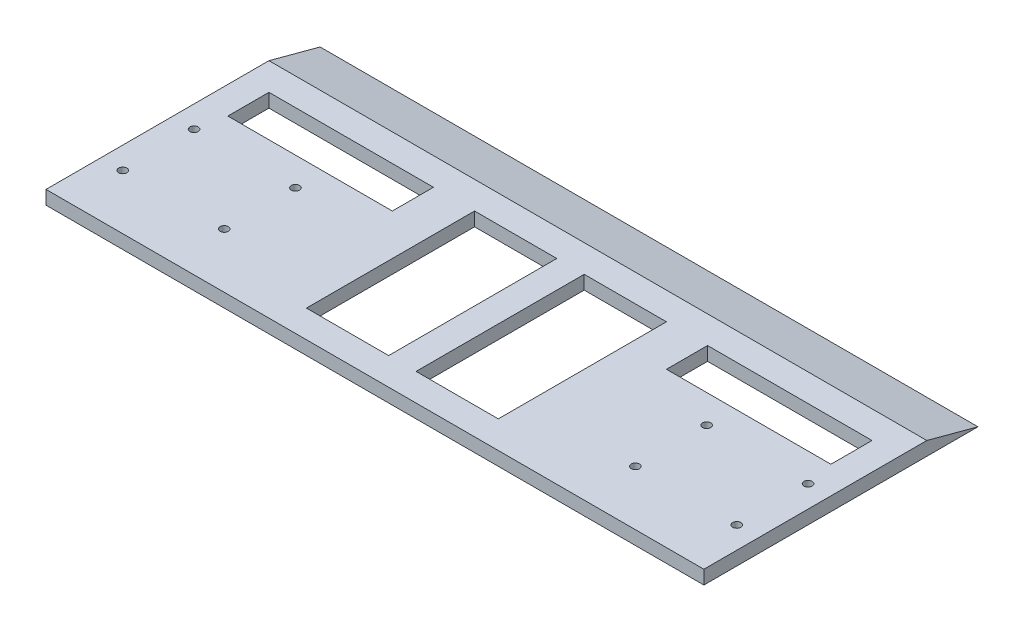
from build123d import *

# Parameters (mm, degrees)
SKETCH_1_W          = 240
SKETCH_1_H          = 100
EXTRUDE_1_DEPTH     = 2.5
CUT_EXTRUDE_1_DEPTH = 261.012018953
SKETCH_3_R          = 1.5
CUT_EXTRUDE_2_DEPTH = 261.048072479
SKETCH_5_W          = 70
SKETCH_5_H          = 61.339745962
CUT_EXTRUDE_4_DEPTH = 10
SKETCH_6_W          = 60
SKETCH_6_H          = 15
CUT_EXTRUDE_5_DEPTH = 10
SKETCH_7_W          = 10
SKETCH_7_H          = 5
EXTRUDE_2_DEPTH     = 70
CHAMFER_1_SIZE      = 1.12


with BuildPart() as part:
    # 草图1 → 凸台-拉伸1 (new, symmetric)
    with BuildSketch(Plane(origin=(0, 0, 0), x_dir=(1, 0, 0), z_dir=(0, 1, 0))):
        with Locations((120, -50)):
            Rectangle(SKETCH_1_W, SKETCH_1_H)
    extrude(amount=EXTRUDE_1_DEPTH, both=True)

    # 草图2 → 切除-拉伸1 (cut, through all)
    with BuildSketch(Plane(origin=(240, 0, 0), x_dir=(0, 0, -1), z_dir=(1, 0, 0))):
        Polygon((0, -2.5), (-18.660254038, 2.5), (0, 2.5), align=None)
    extrude(amount=-CUT_EXTRUDE_1_DEPTH, mode=Mode.SUBTRACT)

    # 草图3 → 切除-拉伸2 (cut, through all)
    with BuildSketch(Plane(origin=(0, 2.5, 0), x_dir=(1, 0, 0), z_dir=(0, 1, 0))):
        with Locations(Location((45, -80, 0), (0, 0, 270))):
            Circle(SKETCH_3_R)
        with Locations(Location((45, -54, 0), (0, 0, 90))):
            Circle(SKETCH_3_R)
        with Locations(Location((8, -80, 0), (0, 0, 90))):
            Circle(SKETCH_3_R)
        with Locations(Location((8, -54, 0), (0, 0, 270))):
            Circle(SKETCH_3_R)
        with Locations(Location((195, -80, 0), (0, 0, 90))):
            Circle(SKETCH_3_R)
        with Locations(Location((195, -54, 0), (0, 0, 270))):
            Circle(SKETCH_3_R)
        with Locations(Location((232, -80, 0), (0, 0, 270))):
            Circle(SKETCH_3_R)
        with Locations(Location((232, -54, 0), (0, 0, 90))):
            Circle(SKETCH_3_R)
    extrude(amount=-CUT_EXTRUDE_2_DEPTH, mode=Mode.SUBTRACT)

    # 草图5 → 切除-拉伸4 (cut)
    with BuildSketch(Plane(origin=(0, 2.5, 0), x_dir=(1, 0, 0), z_dir=(0, 1, 0))):
        with Locations((120, -59.330127019)):
            Rectangle(SKETCH_5_W, SKETCH_5_H)
    extrude(amount=-CUT_EXTRUDE_4_DEPTH, mode=Mode.SUBTRACT)

    # 草图6 → 切除-拉伸5 (cut)
    with BuildSketch(Plane(origin=(0, 2.5, 0), x_dir=(1, 0, 0), z_dir=(0, 1, 0))):
        with Locations((40, -36.160254038)):
            Rectangle(SKETCH_6_W, SKETCH_6_H)
        with Locations((200, -36.160254038)):
            Rectangle(SKETCH_6_W, SKETCH_6_H)
    extrude(amount=-CUT_EXTRUDE_5_DEPTH, mode=Mode.SUBTRACT)

    # 草图7 → 凸台-拉伸2 (add)
    with BuildSketch(Plane.XY.offset(28.660254038)):
        with Locations((120, 0)):
            Rectangle(SKETCH_7_W, SKETCH_7_H)
    extrude(amount=EXTRUDE_2_DEPTH)

    # 倒角1
    chamfer_1_edges = [part.edges().sort_by_distance(p)[0] for p in [
        (195, -2.5, 81.5),
        (8, -2.5, 52.5),
        (8, -2.5, 81.5),
        (45, -2.5, 55.5),
        (232, -2.5, 55.5),
        (232, -2.5, 78.5),
        (195, -2.5, 52.5),
        (45, -2.5, 78.5),
    ]]
    chamfer(chamfer_1_edges, length=CHAMFER_1_SIZE)


solid = part.part
